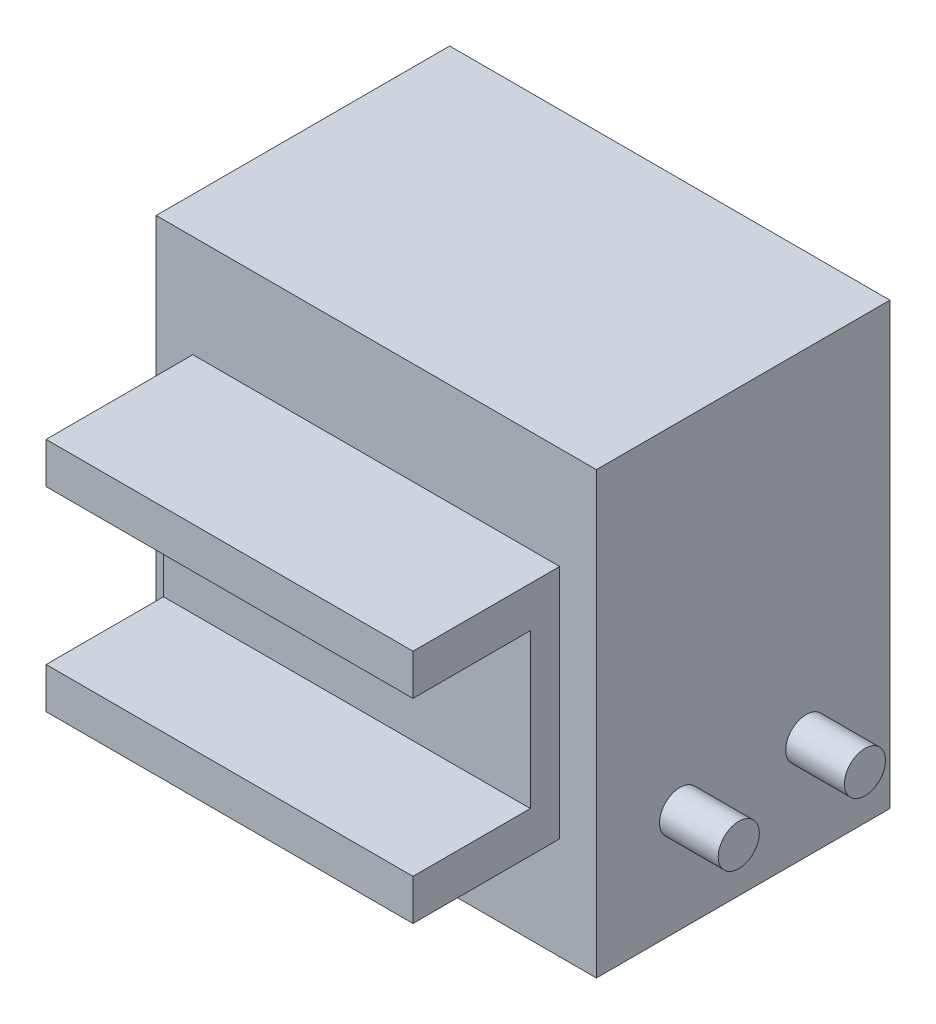
from build123d import *

# Parameters (mm, degrees)
SKETCH_1_W          = 30
SKETCH_1_H          = 20
EXTRUDE_1_DEPTH     = 30
SKETCH_3_W          = 25
SKETCH_3_H          = 16.07
EXTRUDE_2_DEPTH     = 10
SKETCH_7_W          = 8
SKETCH_7_H          = 10.5
CUT_EXTRUDE_1_DEPTH = 45.426074479
SKETCH_9_W          = 17
SKETCH_9_H          = 26
CUT_EXTRUDE_2_DEPTH = 25
SKETCH_11_R         = 1.4
EXTRUDE_3_DEPTH     = 4
SKETCH_12_R         = 1.4
EXTRUDE_4_DEPTH     = 4


with BuildPart() as part:
    # 草图1 → 凸台-拉伸1 (new body)
    with BuildSketch(Plane(origin=(0, 0, 0), x_dir=(1, 0, 0), z_dir=(0, 1, 0))):
        with Locations((-0.371492922, 2.183544304)):
            Rectangle(SKETCH_1_W, SKETCH_1_H)
    extrude(amount=EXTRUDE_1_DEPTH)

    # 草图3 → 凸台-拉伸2 (add)
    with BuildSketch(Plane.XY.offset(7.816455696)):
        with Locations((-0.371492922, 15)):
            Rectangle(SKETCH_3_W, SKETCH_3_H)
    extrude(amount=EXTRUDE_2_DEPTH)

    # 草图7 → 切除-拉伸1 (cut, through all)
    with BuildSketch(Plane.ZY.offset(12.871492922)):
        with Locations((13.816455696, 15)):
            Rectangle(SKETCH_7_W, SKETCH_7_H)
    extrude(amount=-CUT_EXTRUDE_1_DEPTH, mode=Mode.SUBTRACT)

    # 草图9 → 切除-拉伸2 (cut)
    with BuildSketch(Plane.ZY.offset(15.371492922)):
        with Locations((-2.183544304, 15)):
            Rectangle(SKETCH_9_W, SKETCH_9_H)
    extrude(amount=-CUT_EXTRUDE_2_DEPTH, mode=Mode.SUBTRACT)

    # 草图11 → 凸台-拉伸3 (add)
    with BuildSketch(Plane(origin=(14.628507078, 0, 0), x_dir=(0, 0, -1), z_dir=(1, 0, 0))):
        with Locations(Location((-2.116455696, 7, 0), (0, 0, 180))):
            Circle(SKETCH_11_R)
        with Locations(Location((6.483544304, 7, 0), (0, 0, 180))):
            Circle(SKETCH_11_R)
    extrude(amount=EXTRUDE_3_DEPTH)

    # 草图12 → 凸台-拉伸4 (add)
    with BuildSketch(Plane(origin=(0, 0, -12.183544304), x_dir=(-1, 0, 0), z_dir=(0, 0, -1))):
        with Locations(Location((-3.928507078, 7, 0), (0, 0, 180))):
            Circle(SKETCH_12_R)
        with Locations(Location((4.671492922, 7, 0), (0, 0, 180))):
            Circle(SKETCH_12_R)
    extrude(amount=EXTRUDE_4_DEPTH)


solid = part.part
